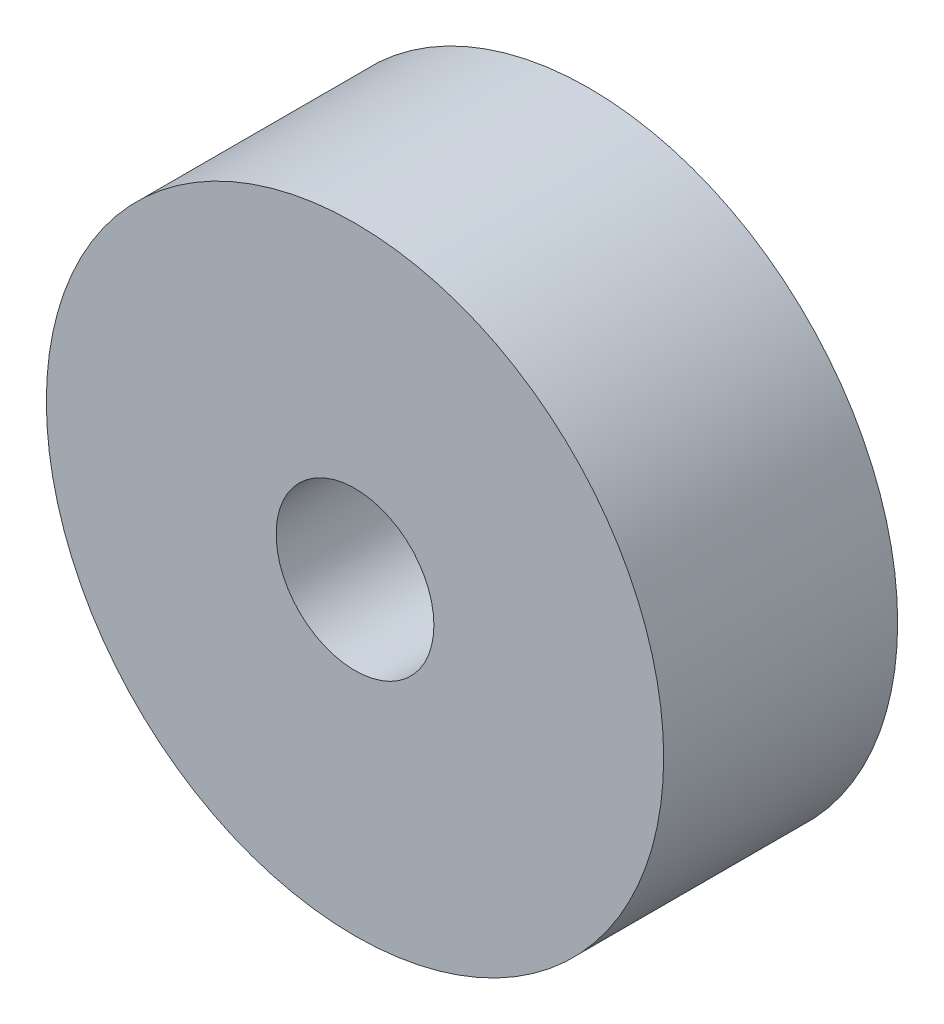
from build123d import *

# Parameters (mm, degrees)
SKETCH1_R           = 6.2992
SKETCH1_R_2         = 1.61
BOSS_EXTRUDE1_DEPTH = 4.7752


with BuildPart() as part:
    # Sketch1 → Boss-Extrude1 (new body)
    with BuildSketch(Plane.XY):
        Circle(SKETCH1_R)
        Circle(SKETCH1_R_2, mode=Mode.SUBTRACT)
    extrude(amount=BOSS_EXTRUDE1_DEPTH)


solid = part.part
